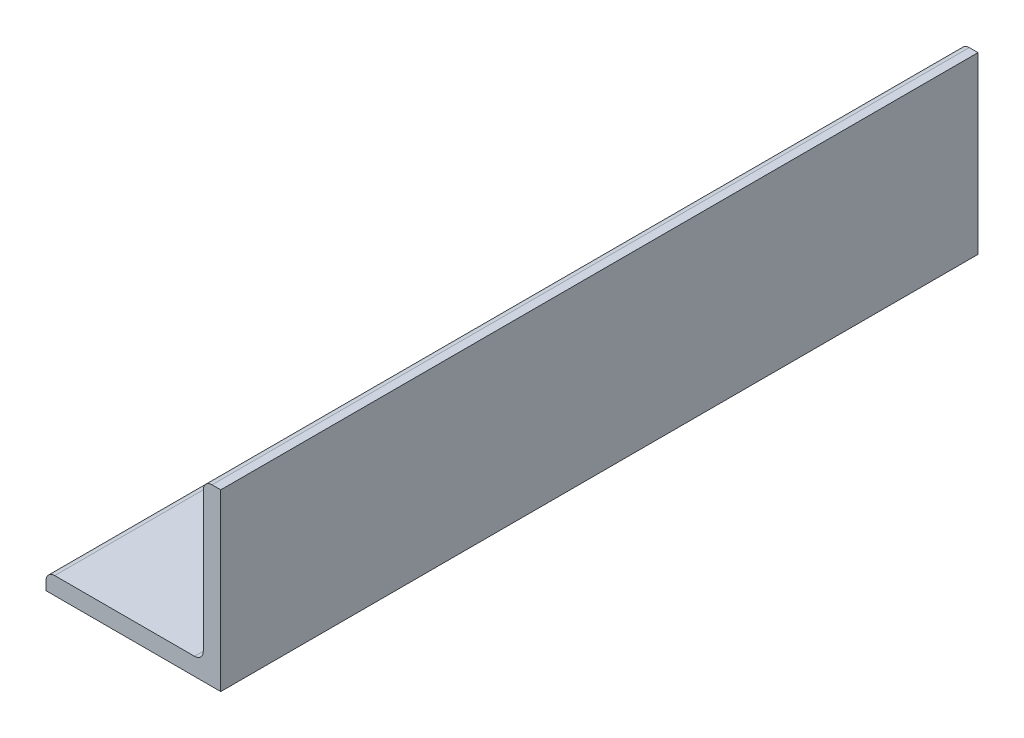
from build123d import *

# Parameters (mm, degrees)
BOSS_EXTRUDE1_DEPTH = 130


with BuildPart() as part:
    # Sketch1 → Boss-Extrude1 (new body)
    with BuildSketch(Plane.XY):
        with BuildLine():
            Line((-135.600940307, 27), (-135.600940307, -3))
            Line((-135.600940307, -3), (-165.600940307, -3))
            Line((-165.600940307, -3), (-165.600940307, -1.5))
            ThreePointArc((-165.600940307, -1.5), (-165.161600478, -0.439339828), (-164.100940307, 0))
            Line((-164.100940307, 0), (-140.100940307, 0))
            ThreePointArc((-140.100940307, 0), (-139.040280135, 0.439339828), (-138.600940307, 1.5))
            Line((-138.600940307, 1.5), (-138.600940307, 25.5))
            ThreePointArc((-138.600940307, 25.5), (-138.161600478, 26.560660172), (-137.100940307, 27))
            Line((-137.100940307, 27), (-135.600940307, 27))
        make_face()
    extrude(amount=BOSS_EXTRUDE1_DEPTH)


solid = part.part
